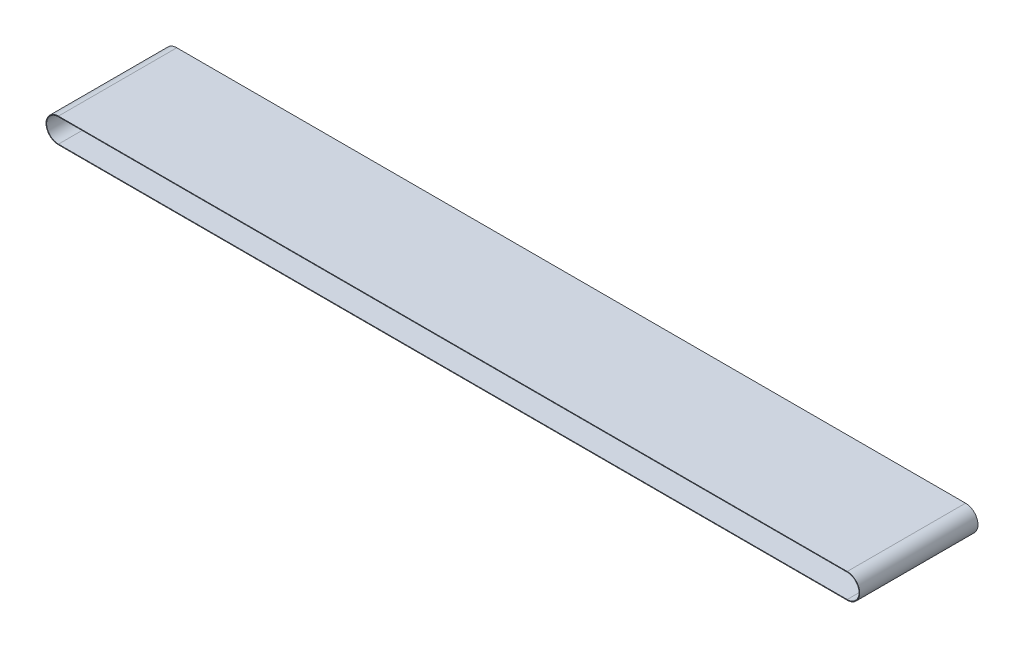
from build123d import *

# Parameters (mm, degrees)
BOSS_EXTRUDE1_DEPTH = 75


with BuildPart() as part:
    # Sketch1 → Boss-Extrude1 (new, symmetric)
    with BuildSketch(Plane.XY):
        with BuildLine():
            Line((0, 15.8), (1000, 15.8))
            ThreePointArc((1000, 15.8), (1015.8, 0), (1000, -15.8))
            Line((1000, -15.8), (0, -15.8))
            ThreePointArc((0, -15.8), (-15.8, 0), (0, 15.8))
        make_face()
        with BuildLine():
            Line((0, 15), (1000, 15))
            ThreePointArc((1000, 15), (1015, 0), (1000, -15))
            Line((1000, -15), (0, -15))
            ThreePointArc((0, -15), (-15, 0), (0, 15))
        make_face(mode=Mode.SUBTRACT)
    extrude(amount=BOSS_EXTRUDE1_DEPTH, both=True)


solid = part.part
